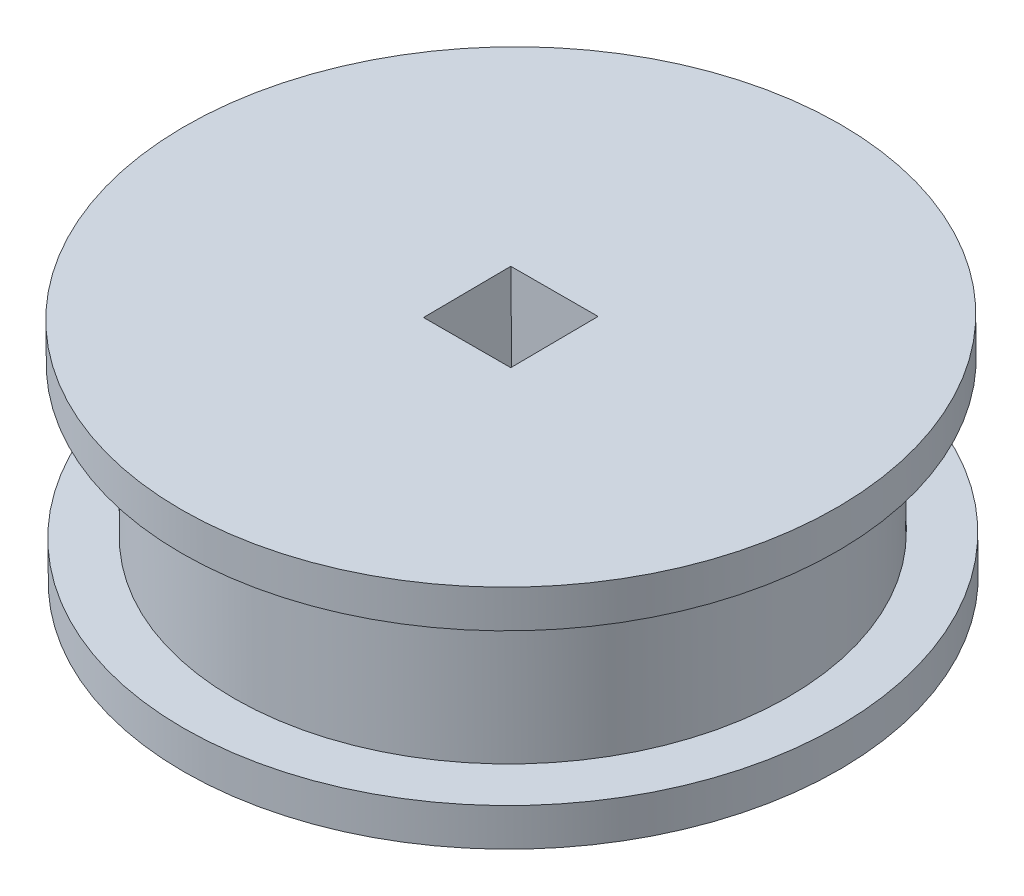
from build123d import *

# Parameters (mm, degrees)
SKETCH2_R           = 11
BOSS_EXTRUDE1_DEPTH = 6
SKETCH3_W           = 3.45
SKETCH3_H           = 3.45
CUT_EXTRUDE1_DEPTH  = 18.841034143
SKETCH4_R           = 13
BOSS_EXTRUDE2_DEPTH = 1.5
SKETCH5_W           = 3.45
SKETCH5_H           = 3.45
CUT_EXTRUDE2_DEPTH  = 22.625712586


with BuildPart() as part:
    # Sketch2 → Boss-Extrude1 (new body)
    with BuildSketch(Plane(origin=(-0.006046198, 2.843115255, 0.024063532), x_dir=(0.9999977389340391, 0.002126453123543878, 1.7997853821493017e-05), z_dir=(-0.00212652928721231, 0.9999619230641714, 0.008463468260412206))):
        with Locations(Location((-2.8797e-05, 1.599942694, 0), (0, 0, 270))):
            Circle(SKETCH2_R)
    extrude(amount=BOSS_EXTRUDE1_DEPTH)

    # Sketch3 → Cut-Extrude1 (cut, through all)
    with BuildSketch(Plane(origin=(-0.018805374, 8.842886793, 0.074844342), x_dir=(0.9999977389340391, 0.002126453123543878, 1.7997853821493024e-05), z_dir=(-0.00212652928721231, 0.9999619230641714, 0.00846346826041221))):
        with Locations((-2.8797e-05, 1.599942694)):
            Rectangle(SKETCH3_W, SKETCH3_H)
    extrude(amount=-CUT_EXTRUDE1_DEPTH, mode=Mode.SUBTRACT)

    # Sketch4 → Boss-Extrude2 (add)
    with BuildSketch(Plane(origin=(-0.018805374, 8.842886793, 0.074844342), x_dir=(0.9999977389340391, 0.002126453123543878, 1.7997853821493024e-05), z_dir=(-0.00212652928721231, 0.9999619230641714, 0.00846346826041221))):
        with Locations(Location((-2.8797e-05, 1.599942694, 0), (0, 0, 270))):
            Circle(SKETCH4_R)
    boss_extrude2 = extrude(amount=BOSS_EXTRUDE2_DEPTH)

    # Mirror1: Boss-Extrude2 across plane
    add(boss_extrude2.mirror(Plane(origin=(-0.012425786, 5.843001024, 0.049453937), x_dir=(1.79984577561216e-05, -0.008463449122581367, 0.9999641842111171), z_dir=(0.00212652928721231, -0.9999619230641714, -0.00846346826041221))))

    # Sketch5 → Cut-Extrude2 (cut, through all)
    with BuildSketch(Plane(origin=(-0.021995168, 10.342829678, 0.087539544), x_dir=(0.9999977389340391, 0.002126453123543878, 1.799785382149303e-05), z_dir=(-0.00212652928721231, 0.9999619230641714, 0.008463468260412213))):
        with Locations((-2.8797e-05, 1.599942694)):
            Rectangle(SKETCH5_W, SKETCH5_H)
    extrude(amount=-CUT_EXTRUDE2_DEPTH, mode=Mode.SUBTRACT)


solid = part.part
